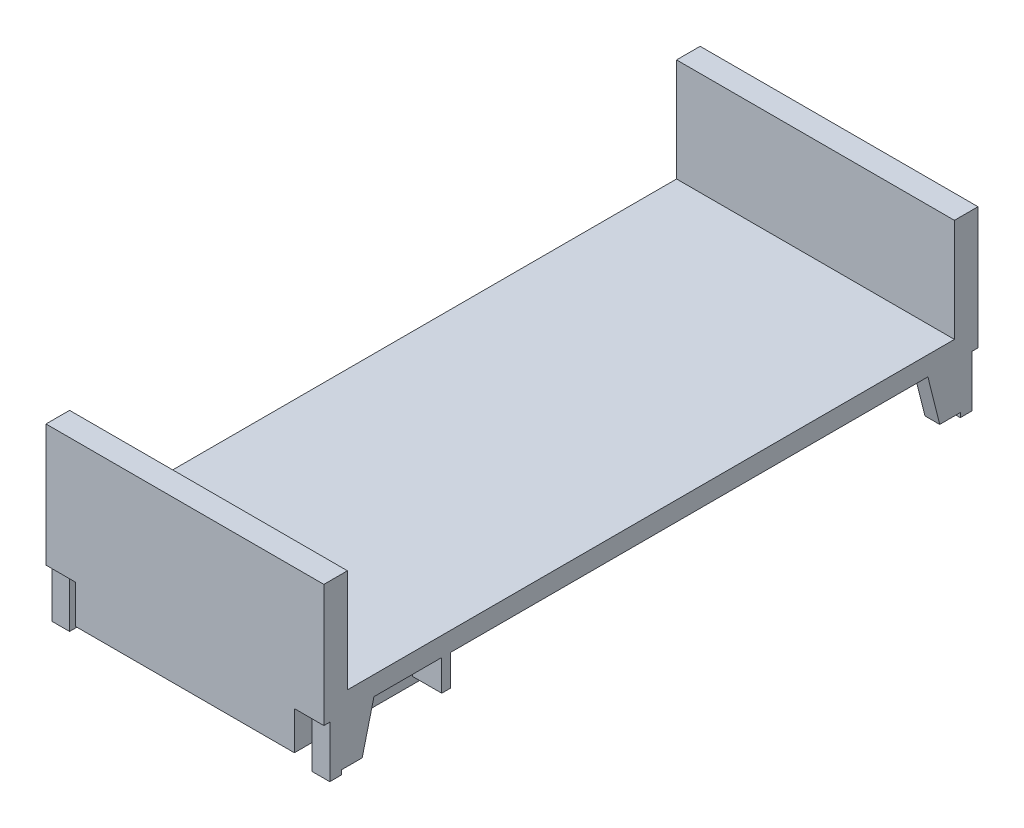
from build123d import *

# Parameters (mm, degrees)
SKETCH1_W                = 40
SKETCH1_H                = 40
SKETCH1_H_2              = 10
SKETCH1_W_2              = 903
SKETCH1_H_3              = 2060
BOSS_EXTRUDE1_DEPTH      = 65
BOSS_EXTRUDE2_DEPTH      = 350
BOSS_EXTRUDE2_DEPTH_BACK = 50
SKETCH1_3_W              = 943
SKETCH1_3_H              = 80
SKETCH1_4_W              = 40
SKETCH1_4_H              = 40
BOSS_EXTRUDE3_DEPTH      = 240
BOSS_EXTRUDE4_DEPTH      = 30
BOSS_EXTRUDE5_DEPTH      = 30
SKETCH5_W                = 30
SKETCH5_H                = 30
CUT_EXTRUDE1_DEPTH       = 200
BOSS_EXTRUDE6_DEPTH      = 30
BOSS_EXTRUDE7_START      = -30
BOSS_EXTRUDE7_DEPTH      = 30
BOSS_EXTRUDE8_DEPTH      = 20
BOSS_EXTRUDE8_DEPTH_BACK = 20
SKETCH8_W                = 743
SKETCH8_H                = 450
BOSS_EXTRUDE9_DEPTH      = 130
SKETCH9_W                = 50
SKETCH9_H                = 50
BOSS_EXTRUDE11_DEPTH     = 750
SKETCH9_3_W              = 50
SKETCH9_3_H              = 50
BOSS_EXTRUDE12_DEPTH     = 1170
SKETCH10_W               = 50
SKETCH10_H               = 50
BOSS_EXTRUDE13_DEPTH     = 85
BOSS_EXTRUDE14_DEPTH     = 20
BOSS_EXTRUDE15_DEPTH     = 20
SKETCH14_W               = 943
SKETCH14_H               = 30
BOSS_EXTRUDE16_DEPTH     = 105


with BuildPart() as part:
    # Sketch1 → Boss-Extrude1 (new body)
    with BuildSketch(Plane(origin=(0, 0, 0), x_dir=(1, 0, 0), z_dir=(0, 1, 0))):
        with Locations((-431.5, 20)):
            Rectangle(SKETCH1_W, SKETCH1_H)
        Polygon((-411.5, 50), (-411.5, 40), (-411.5, 0), (411.5, 0), (411.5, 40), (411.5, 50), align=None)
        with Locations((-431.5, 45)):
            Rectangle(SKETCH1_W, SKETCH1_H_2)
        Polygon((-451.5, 0), (-451.5, 40), (-451.5, 50), (-451.5, 60), (-471.5, 60), (-471.5, -20), (471.5, -20), (471.5, 60), (451.5, 60), (451.5, 50), (451.5, 40), (451.5, 0), (411.5, 0), (-411.5, 0), align=None)
        Polygon((-451.5, 50), (-411.5, 50), (411.5, 50), (451.5, 50), (451.5, 60), (-451.5, 60), align=None)
        with Locations((431.5, 20)):
            Rectangle(SKETCH1_W, SKETCH1_H)
        with Locations((431.5, 45)):
            Rectangle(SKETCH1_W, SKETCH1_H_2)
        with Locations((0, 1090)):
            Rectangle(SKETCH1_W_2, SKETCH1_H_3)
        Polygon((-471.5, 2120), (-451.5, 2120), (-451.5, 2130), (-451.5, 2140), (-451.5, 2180), (-411.5, 2180), (411.5, 2180), (451.5, 2180), (451.5, 2140), (451.5, 2130), (451.5, 2120), (471.5, 2120), (471.5, 2200), (-471.5, 2200), align=None)
        Polygon((-451.5, 2130), (-451.5, 2120), (451.5, 2120), (451.5, 2130), (411.5, 2130), (-411.5, 2130), align=None)
        with Locations((-431.5, 2135)):
            Rectangle(SKETCH1_W, SKETCH1_H_2)
        with Locations((-431.5, 2160)):
            Rectangle(SKETCH1_W, SKETCH1_H)
        Polygon((-411.5, 2140), (-411.5, 2130), (411.5, 2130), (411.5, 2140), (411.5, 2180), (-411.5, 2180), align=None)
        with Locations((431.5, 2135)):
            Rectangle(SKETCH1_W, SKETCH1_H_2)
        with Locations((431.5, 2160)):
            Rectangle(SKETCH1_W, SKETCH1_H)
    extrude(amount=-BOSS_EXTRUDE1_DEPTH)

    # Sketch1<3> → Boss-Extrude2 (add, two sides: drawn at the far end of the back side and taken through both)
    with BuildSketch(Plane(origin=(0, 0, 0), x_dir=(1, 0, 0), z_dir=(0, 1, 0)).offset(-BOSS_EXTRUDE2_DEPTH_BACK)):
        with Locations((0, 2160)):
            Rectangle(SKETCH1_3_W, SKETCH1_3_H)
        with Locations((0, 20)):
            Rectangle(SKETCH1_3_W, SKETCH1_3_H)
    extrude(amount=BOSS_EXTRUDE2_DEPTH + BOSS_EXTRUDE2_DEPTH_BACK)

    # Sketch1<4> → Boss-Extrude3 (add)
    with BuildSketch(Plane(origin=(0, 0, 0), x_dir=(1, 0, 0), z_dir=(0, 1, 0))):
        with Locations((431.5, 2160)):
            Rectangle(SKETCH1_4_W, SKETCH1_4_H)
        with Locations((-431.5, 2160)):
            Rectangle(SKETCH1_4_W, SKETCH1_4_H)
        with Locations((-431.5, 20)):
            Rectangle(SKETCH1_4_W, SKETCH1_4_H)
        with Locations((431.5, 20)):
            Rectangle(SKETCH1_4_W, SKETCH1_4_H)
    extrude(amount=-BOSS_EXTRUDE3_DEPTH)

    # Sketch3 → Boss-Extrude4 (add)
    with BuildSketch(Plane(origin=(451.5, 0, 0), x_dir=(0, 0, -1), z_dir=(1, 0, 0))):
        Polygon((40, -65), (40, -225), (110, -225), (150, -65), align=None)
        Polygon((2140, -65), (2030, -65), (2070, -225), (2140, -225), align=None)
    extrude(amount=-BOSS_EXTRUDE4_DEPTH)

    # Sketch4 → Boss-Extrude5 (add)
    with BuildSketch(Plane(origin=(-451.5, 0, -45.75), x_dir=(0, 0, -1), z_dir=(1, 0, 0))):
        Polygon((2024.25, -225), (2094.25, -225), (2094.25, -65), (1984.25, -65), align=None)
        Polygon((64.25, -225), (104.25, -65), (-5.75, -65), (-5.75, -225), align=None)
    extrude(amount=BOSS_EXTRUDE5_DEPTH)

    # Sketch5 → Cut-Extrude1 (cut)
    with BuildSketch(Plane.XZ.offset(240)):
        with Locations((-431.5, -2160)):
            Rectangle(SKETCH5_W, SKETCH5_H)
        with Locations((431.5, -2160)):
            Rectangle(SKETCH5_W, SKETCH5_H)
        with Locations((431.5, -20)):
            Rectangle(SKETCH5_W, SKETCH5_H)
        with Locations((-431.5, -20)):
            Rectangle(SKETCH5_W, SKETCH5_H)
    extrude(amount=-CUT_EXTRUDE1_DEPTH, mode=Mode.SUBTRACT)

    # Sketch6 → Boss-Extrude6 (add)
    with BuildSketch(Plane.XY.offset(20)):
        with BuildLine():
            Line((130, -65), (-130, -65))
            ThreePointArc((-130, -65), (0, -195), (130, -65))
        make_face()
    extrude(amount=-BOSS_EXTRUDE6_DEPTH)

    # Sketch7 → Boss-Extrude7 (add)
    with BuildSketch(Plane(origin=(0, 0, -2200), x_dir=(-1, 0, 0), z_dir=(0, 0, -1)).offset(BOSS_EXTRUDE7_START)):
        with BuildLine():
            Line((130, -65), (-130, -65))
            ThreePointArc((-130, -65), (0, -195), (130, -65))
        make_face()
    extrude(amount=BOSS_EXTRUDE7_DEPTH)

    # 3DSketch1 → Boss-Extrude8 (add, two sides: drawn at the far end of the back side and taken through both)
    with BuildSketch(Plane(origin=(0, -195, -10), x_dir=(0, 0.018515344006020947, -0.9998285763251313), z_dir=(1, 0, 0)).offset(-BOSS_EXTRUDE8_DEPTH_BACK)):
        Polygon((0, 0), (0.74061376, 39.993143053), (2160.370338623, 0), (2159.629724862, -39.993143053), align=None)
    extrude(amount=BOSS_EXTRUDE8_DEPTH + BOSS_EXTRUDE8_DEPTH_BACK)

    # Sketch8 → Boss-Extrude9 (add)
    with BuildSketch(Plane.XZ.offset(65)):
        with Locations((0, -205)):
            Rectangle(SKETCH8_W, SKETCH8_H)
    extrude(amount=BOSS_EXTRUDE9_DEPTH)

    # Sketch9 → Boss-Extrude11 (add)
    with BuildSketch(Plane(origin=(0, 0, -430), x_dir=(-1, 0, 0), z_dir=(0, 0, -1))):
        with Locations((-346.5, -75)):
            Rectangle(SKETCH9_W, SKETCH9_H)
    extrude(amount=BOSS_EXTRUDE11_DEPTH)

    # Sketch9<3> → Boss-Extrude12 (add)
    with BuildSketch(Plane(origin=(0, 0, -430), x_dir=(-1, 0, 0), z_dir=(0, 0, -1))):
        with Locations((346.5, -125)):
            Rectangle(SKETCH9_3_W, SKETCH9_3_H)
    extrude(amount=BOSS_EXTRUDE12_DEPTH)

    # Sketch10 → Boss-Extrude13 (add)
    with BuildSketch(Plane.XZ.offset(150)):
        with Locations((-346.5, -1575)):
            Rectangle(SKETCH10_W, SKETCH10_H)
    extrude(amount=-BOSS_EXTRUDE13_DEPTH)

    # Sketch12 → Boss-Extrude14 (add)
    with BuildSketch(Plane.ZY.offset(451.5)):
        Polygon((-60, 0), (-2120, 0), (-2120, -65), (-2180, -65), (-2180, -240), (-2140, -240), (-2140, -225), (-2070, -225), (-2030, -65), (-150, -65), (-110, -225), (-40, -225), (-40, -240), (0, -240), (0, -65), (-60, -65), align=None)
    extrude(amount=BOSS_EXTRUDE14_DEPTH)

    # Sketch13 → Boss-Extrude15 (add)
    with BuildSketch(Plane(origin=(451.5, 0, 0), x_dir=(0, 0, -1), z_dir=(1, 0, 0))):
        Polygon((2120, 0), (60, 0), (60, -65), (0, -65), (0, -240), (40, -240), (40, -225), (110, -225), (150, -65), (2030, -65), (2070, -225), (2140, -225), (2140, -240), (2180, -240), (2180, -65), (2120, -65), align=None)
    extrude(amount=BOSS_EXTRUDE15_DEPTH)

    # Sketch14 → Boss-Extrude16 (add)
    with BuildSketch(Plane.XZ.offset(65)):
        with Locations((0, -395)):
            Rectangle(SKETCH14_W, SKETCH14_H)
    extrude(amount=BOSS_EXTRUDE16_DEPTH)


solid = part.part
